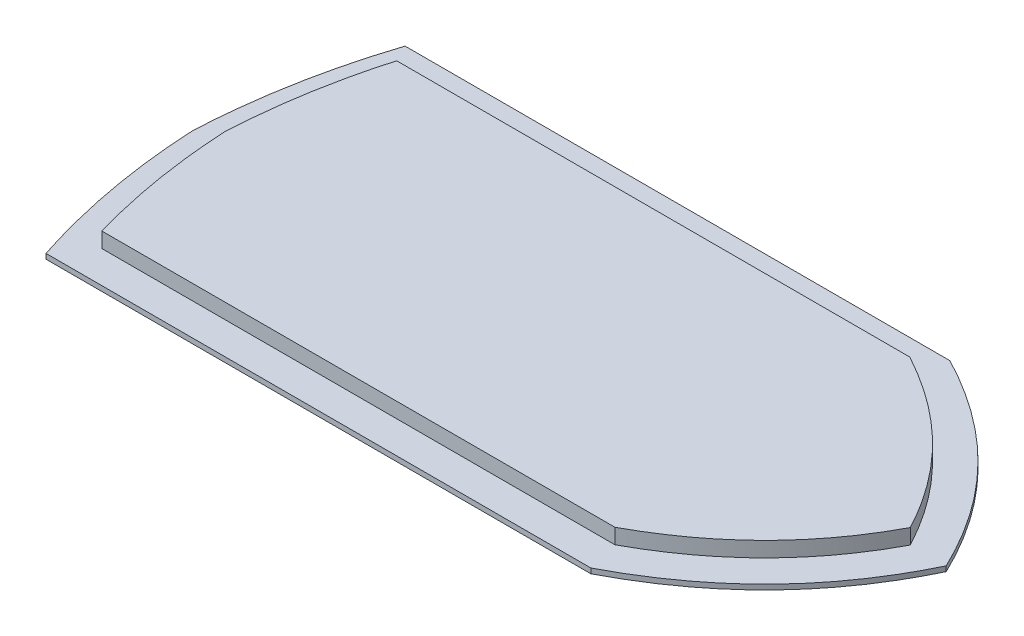
from build123d import *

# Parameters (mm, degrees)
SALIENTE_EXTRUIR4_DEPTH = 1
SALIENTE_EXTRUIR5_DEPTH = 4


with BuildPart() as part:
    # Croquis1 → Saliente-Extruir4 (new body)
    with BuildSketch(Plane(origin=(0, 0, 0), x_dir=(1, 0, 0), z_dir=(0, 1, 0))):
        with BuildLine():
            Line((-68.807549393, -35.735609902), (38.825281278, -35.735609902))
            add(Edge.make_bspline(
                [(38.825281278, -35.735609902), (38.857624552, -35.718822416), (38.889937105, -35.702026903), (40.163492425, -35.039106907), (41.363053394, -34.379508835), (44.879608288, -32.340972971), (47.103940203, -30.908125592), (53.416675645, -26.4056608), (57.158292578, -23.128173527), (63.889280185, -15.928414127), (66.879657947, -12.004947025), (70.871982915, -5.502682168), (72.121484201, -3.228479298), (73.380247303, -0.652201666), (73.473116384, -0.460315749), (73.565425725, -0.267750564)],
                knots=[0.132682558, 0.132682558, 0.132682558, 0.132682558, 0.13425238, 0.13425238, 0.194615488, 0.194615488, 0.315341705, 0.315341705, 0.556794137, 0.556794137, 0.79824657, 0.79824657, 0.918972787, 0.918972787, 0.928652581, 0.928652581, 0.928652581, 0.928652581], degree=3))
            add(Edge.make_bspline(
                [(73.565425725, -0.267750564), (73.473116384, -0.07518538), (73.380247303, 0.116700538), (72.121484201, 2.692978169), (70.871982915, 4.967181039), (66.879657947, 11.469445896), (63.889280185, 15.392912998), (57.158292578, 22.592672399), (53.416675646, 25.870159671), (47.103940203, 30.372624464), (44.879608287, 31.805471842), (41.363053394, 33.844007706), (40.163492425, 34.503605779), (38.889937105, 35.166525774), (38.857624552, 35.183321288), (38.825281278, 35.200108773)],
                knots=[0.132682558, 0.132682558, 0.132682558, 0.132682558, 0.142362352, 0.142362352, 0.263088569, 0.263088569, 0.504541001, 0.504541001, 0.745993434, 0.745993434, 0.866719651, 0.866719651, 0.927082759, 0.927082759, 0.928652581, 0.928652581, 0.928652581, 0.928652581], degree=3))
            Line((38.825281278, 35.200108773), (-68.807549393, 35.200108773))
            add(Edge.make_bspline(
                [(-68.807549393, 35.200108773), (-70.080284046, 31.302990951), (-71.169252334, 27.374853959), (-72.991045883, 19.413196683), (-73.721201284, 15.377083685), (-74.541341264, 9.255508785), (-74.768651118, 7.205452815), (-75.107581304, 3.346349854), (-75.230698844, 1.538874232), (-75.318593087, -0.267750565)],
                knots=[0.290505717, 0.290505717, 0.290505717, 0.290505717, 0.524524567, 0.524524567, 0.760550999, 0.760550999, 0.878564216, 0.878564216, 0.980861336, 0.980861336, 0.980861336, 0.980861336], degree=3))
            add(Edge.make_bspline(
                [(-75.318593087, -0.267750565), (-75.230698844, -2.074375361), (-75.107581304, -3.881850983), (-74.768651118, -7.740953944), (-74.541341264, -9.791009913), (-73.721201284, -15.912584814), (-72.991045883, -19.948697811), (-71.169252334, -27.910355088), (-70.080284046, -31.838492079), (-68.807549393, -35.735609902)],
                knots=[0.290505717, 0.290505717, 0.290505717, 0.290505717, 0.392802838, 0.392802838, 0.510816054, 0.510816054, 0.746842486, 0.746842486, 0.980861336, 0.980861336, 0.980861336, 0.980861336], degree=3))
        make_face()
    extrude(amount=SALIENTE_EXTRUIR4_DEPTH)

    # Croquis4 → Saliente-Extruir5 (add)
    with BuildSketch(Plane(origin=(0, 0, 0), x_dir=(1, 0, 0), z_dir=(0, 1, 0))):
        with BuildLine():
            Line((37.247663382, 28.855017698), (-64.119969997, 28.855017698))
            add(Edge.make_bspline(
                [(-64.119969997, 28.855017698), (-65.485825703, 24.110871923), (-66.573936798, 19.303338214), (-68.190809552, 9.563299345), (-68.714330818, 4.66248528), (-68.96563874, -0.267750565)],
                knots=[0, 0, 0, 0, 0.5, 0.5, 1, 1, 1, 1], degree=3))
            add(Edge.make_bspline(
                [(-64.119969997, -29.390518826), (-65.485825703, -24.646373051), (-66.573936798, -19.838839342), (-68.190809552, -10.098800474), (-68.714330818, -5.197986409), (-68.96563874, -0.267750565)],
                knots=[0, 0, 0, 0, 0.5, 0.5, 1, 1, 1, 1], degree=3))
            Line((-64.119969997, -29.390518826), (37.247663382, -29.390518826))
            add(Edge.make_bspline(
                [(66.462106503, -0.267750564), (64.818621385, -3.374433842), (62.975742409, -6.335483667), (59.886080558, -10.539433832), (58.80173399, -11.900974536), (57.091612362, -13.882224457), (56.507662174, -14.532481759), (55.311926642, -15.812666099), (54.698983392, -16.443734837), (51.578159003, -19.532591798), (48.914439134, -21.777803713), (43.292419218, -25.869940939), (40.335081649, -27.71816757), (37.247663382, -29.390518826)],
                knots=[0, 0, 0, 0, 0.25, 0.25, 0.375, 0.375, 0.4375, 0.4375, 0.5, 0.5, 0.75, 0.75, 1, 1, 1, 1], degree=3))
            add(Edge.make_bspline(
                [(66.462106503, -0.267750564), (64.818621385, 2.838932714), (62.975742409, 5.799982539), (59.886080558, 10.003932703), (58.80173399, 11.365473408), (57.091612362, 13.346723328), (56.507662174, 13.996980631), (55.311926642, 15.277164971), (54.698983392, 15.908233708), (51.578159003, 18.99709067), (48.914439134, 21.242302584), (43.292419218, 25.334439811), (40.335081649, 27.182666442), (37.247663382, 28.855017698)],
                knots=[0, 0, 0, 0, 0.25, 0.25, 0.375, 0.375, 0.4375, 0.4375, 0.5, 0.5, 0.75, 0.75, 1, 1, 1, 1], degree=3))
        make_face()
    extrude(amount=SALIENTE_EXTRUIR5_DEPTH)


solid = part.part
